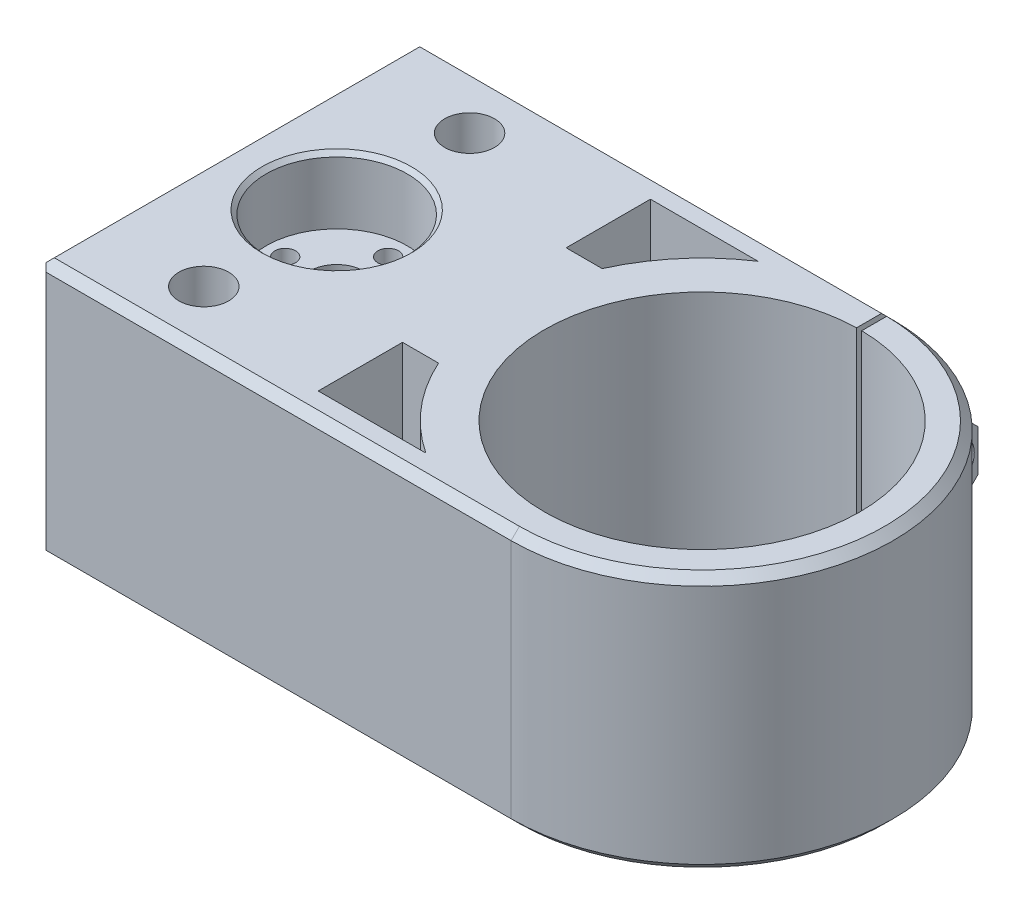
from build123d import *

# Parameters (mm, degrees)
BOSS_EXTRUDE1_DEPTH       = 31
SKETCH2_W                 = 4
SKETCH2_H                 = 6
CUT_EXTRUDE1_DEPTH        = 10
CHAMFER1_SIZE             = 3
SKETCH3_R                 = 1
CUT_EXTRUDE2_DEPTH        = 12
SKETCH4_R                 = 2.75
CUT_EXTRUDE3_DEPTH        = 3
M3X0_5_TAPPED_HOLE1_D     = 2.5
M3X0_5_TAPPED_HOLE1_DEPTH = 5.5
M3X0_5_TAPPED_HOLE1_TIP   = 0.751075774
CHAMFER2_SIZE             = 1
CHAMFER3_SIZE             = 1
CHAMFER4_SIZE             = 1
CHAMFER5_SIZE             = 1
CHAMFER6_SIZE             = 1
SKETCH6_R                 = 3
CUT_EXTRUDE4_DEPTH        = 76.325976363
SKETCH7_R                 = 8.5
CUT_EXTRUDE5_DEPTH        = 8
CHAMFER7_SIZE             = 0.5
CHAMFER8_SIZE             = 0.5
SKETCH8_R                 = 3.25
CUT_EXTRUDE6_DEPTH        = 73.401676189
SKETCH9_R                 = 1
CUT_EXTRUDE7_DEPTH        = 26
CIRPATTERN1_COUNT         = 4


with BuildPart() as part:
    # Sketch1 → Boss-Extrude1 (new body)
    with BuildSketch(Plane(origin=(0, 0, 0), x_dir=(1, 0, 0), z_dir=(0, 1, 0))):
        with BuildLine():
            Line((38.438211647, 10.935520299), (38.438211647, 20.93675572))
            Line((38.438211647, 20.93675572), (42.438211647, 20.93675572))
            Line((42.438211647, 20.93675572), (42.438211647, 14.546924278))
            ThreePointArc((42.438211647, 14.546924278), (61.123879761, -10.180568437), (38.22154498, -31.06324428))
            Line((38.22154498, -31.06324428), (-18.77845502, -31.06324428))
            Line((-18.77845502, -31.06324428), (-18.77845502, 14.93675572))
            Line((-18.77845502, 14.93675572), (33.82154498, 14.93675572))
            Line((33.82154498, 14.93675572), (33.82154498, 20.93675572))
            Line((33.82154498, 20.93675572), (37.82154498, 20.93675572))
            Line((37.82154498, 20.93675572), (37.82154498, 10.932544727))
            ThreePointArc((37.82154498, 10.932544727), (38.31322372, -27.063023095), (38.438211647, 10.935520299))
        make_face()
        with BuildLine():
            Line((12, 11.93675572), (12, 1.788697084))
            Line((12, 1.788697084), (16.336864234, 1.788697084))
            ThreePointArc((16.336864234, 1.788697084), (19.928181819, 7.472291251), (24.955045819, 11.93675572))
            Line((24.955045819, 11.93675572), (12, 11.93675572))
        make_face(mode=Mode.SUBTRACT)
        with BuildLine():
            Line((12, -17.915185645), (16.336864234, -17.915185645))
            ThreePointArc((16.336864234, -17.915185645), (19.928181819, -23.598779812), (24.955045819, -28.06324428))
            Line((24.955045819, -28.06324428), (12, -28.06324428))
            Line((12, -28.06324428), (12, -17.915185645))
        make_face(mode=Mode.SUBTRACT)
    extrude(amount=BOSS_EXTRUDE1_DEPTH)

    # Sketch2 → Cut-Extrude1 (cut)
    with BuildSketch(Plane(origin=(0, 31, 0), x_dir=(1, 0, 0), z_dir=(0, 1, 0))):
        with BuildLine():
            Line((38.438211647, 20.93675572), (38.438211647, 14.93675572))
            ThreePointArc((38.438211647, 14.93675572), (40.446719395, 14.829888823), (42.438211647, 14.547962381))
            Line((42.438211647, 14.547962381), (42.438211647, 20.93675572))
            Line((42.438211647, 20.93675572), (38.438211647, 20.93675572))
        make_face()
        with Locations((35.82154498, 17.93675572)):
            Rectangle(SKETCH2_W, SKETCH2_H)
    cut_extrude1 = extrude(amount=-CUT_EXTRUDE1_DEPTH, mode=Mode.SUBTRACT)

    # Mirror1: Cut-Extrude1 across plane
    add(cut_extrude1.mirror(Plane.ZX.offset(15.5)), mode=Mode.SUBTRACT)

    # Chamfer1
    chamfer1_edges = [part.edges().sort_by_distance(p)[0] for p in [
        (40.438211647, 10, -20.93675572),
        (35.82154498, 10, -20.93675572),
        (40.438211647, 21, -20.93675572),
        (35.82154498, 21, -20.93675572),
    ]]
    chamfer(chamfer1_edges, length=CHAMFER1_SIZE)

    # Sketch3 → Cut-Extrude2 (cut)
    with BuildSketch(Plane(origin=(42.438211647, 0, 0), x_dir=(0, 0, -1), z_dir=(1, 0, 0))):
        with Locations((17.73675572, 15.5)):
            Circle(SKETCH3_R)
    extrude(amount=-CUT_EXTRUDE2_DEPTH, mode=Mode.SUBTRACT)

    # Sketch4 → Cut-Extrude3 (cut)
    with BuildSketch(Plane(origin=(42.438211647, 0, 0), x_dir=(0, 0, -1), z_dir=(1, 0, 0))):
        with Locations((17.73675572, 15.5)):
            Circle(SKETCH4_R)
    extrude(amount=-CUT_EXTRUDE3_DEPTH, mode=Mode.SUBTRACT)

    # M3x0.5 Tapped Hole1
    with Locations(Plane(origin=(33.82154498, 15.5, -17.73675572), x_dir=(0, 0, -1), z_dir=(-1, 0, 0))):
        with Locations((0, 0)):
            Hole(M3X0_5_TAPPED_HOLE1_D / 2, depth=M3X0_5_TAPPED_HOLE1_DEPTH)
            with Locations((0, 0, -(M3X0_5_TAPPED_HOLE1_DEPTH + M3X0_5_TAPPED_HOLE1_TIP / 2))):  # 118° drill point
                Cone(0, M3X0_5_TAPPED_HOLE1_D / 2, M3X0_5_TAPPED_HOLE1_TIP, mode=Mode.SUBTRACT)

    # Chamfer2
    chamfer2_edges = [part.edges().sort_by_distance(p)[0] for p in [
        (61.123879761, 31, 10.180568437),
        (9.52154498, 31, -14.93675572),
        (-18.77845502, 31, 8.06324428),
        (9.72154498, 31, 31.06324428),
    ]]
    chamfer(chamfer2_edges, length=CHAMFER2_SIZE)

    # Chamfer3
    chamfer3_edges = [part.edges().sort_by_distance(p)[0] for p in [
        (40.446719395, 31, -14.829888823),
    ]]
    chamfer(chamfer3_edges, length=CHAMFER3_SIZE)

    # Chamfer4
    chamfer4_edges = [part.edges().sort_by_distance(p)[0] for p in [
        (9.52154498, 0, -14.93675572),
        (61.123879761, 0, 10.180568437),
        (9.72154498, 0, 31.06324428),
        (-18.77845502, 0, 8.06324428),
    ]]
    chamfer(chamfer4_edges, length=CHAMFER4_SIZE)

    # Chamfer5
    chamfer5_edges = [part.edges().sort_by_distance(p)[0] for p in [
        (40.446719395, 0, -14.829888823),
    ]]
    chamfer(chamfer5_edges, length=CHAMFER5_SIZE)

    # Chamfer6
    chamfer6_edges = [part.edges().sort_by_distance(p)[0] for p in [
        (-18.77845502, 15.5, -14.93675572),
        (-18.77845502, 15.5, 31.06324428),
    ]]
    chamfer(chamfer6_edges, length=CHAMFER6_SIZE)

    # Sketch6 → Cut-Extrude4 (cut, through all)
    with BuildSketch(Plane(origin=(0, 31, 0), x_dir=(1, 0, 0), z_dir=(0, 1, 0))):
        with Locations(Location((-5.77845502, -24.06324428, 0), (0, 0, 270))):
            Circle(SKETCH6_R)
        with Locations(Location((-5.77845502, 7.93675572, 0), (0, 0, 270))):
            Circle(SKETCH6_R)
    extrude(amount=-CUT_EXTRUDE4_DEPTH, mode=Mode.SUBTRACT)

    # Sketch7 → Cut-Extrude5 (cut)
    with BuildSketch(Plane(origin=(0, 31, 0), x_dir=(1, 0, 0), z_dir=(0, 1, 0))):
        with Locations(Location((-5.77845502, -8.06324428, 0), (0, 0, 270))):
            Circle(SKETCH7_R)
    cut_extrude5 = extrude(amount=-CUT_EXTRUDE5_DEPTH, mode=Mode.SUBTRACT)

    # Chamfer7
    chamfer7_edges = [part.edges().sort_by_distance(p)[0] for p in [
        (-5.77845502, 31, -0.43675572),
    ]]
    chamfer(chamfer7_edges, length=CHAMFER7_SIZE)

    # Mirror3: Cut-Extrude5 across plane
    add(cut_extrude5.mirror(Plane.ZX.offset(15.5)), mode=Mode.SUBTRACT)

    # Chamfer8
    chamfer8_edges = [part.edges().sort_by_distance(p)[0] for p in [
        (-5.77845502, 0, -0.43675572),
    ]]
    chamfer(chamfer8_edges, length=CHAMFER8_SIZE)

    # Sketch8 → Cut-Extrude6 (cut, through all)
    with BuildSketch(Plane(origin=(0, 23, 0), x_dir=(1, 0, 0), z_dir=(0, 1, 0))):
        with Locations(Location((-5.77845502, -8.06324428, 0), (0, 0, 270))):
            Circle(SKETCH8_R)
    extrude(amount=-CUT_EXTRUDE6_DEPTH, mode=Mode.SUBTRACT)

    # Sketch9 → Cut-Extrude7 (cut)
    with BuildSketch(Plane(origin=(0, 23, 0), x_dir=(1, 0, 0), z_dir=(0, 1, 0))):
        with Locations(Location((-5.77845502, -1.86324428, 0), (0, 0, 270))):
            Circle(SKETCH9_R)
    cut_extrude7 = extrude(amount=-CUT_EXTRUDE7_DEPTH, mode=Mode.SUBTRACT)

    # Sketch10 → M3x0.5 Tapped Hole2 (revolve, cut)
    with BuildSketch(Plane(origin=(-5.77845502, 23, 1.86324428), x_dir=(0, 0, 1), z_dir=(1, 0, 0))):
        Polygon((0, 0), (0, 27.251075774), (1.25, 26.5), (1.25, 0), align=None)
    m3x0_5_tapped_hole2 = revolve(axis=Axis((-5.77845502, 29.35, 1.86324428), (0, -1, 0)), mode=Mode.SUBTRACT)

    # CirPattern1: Cut-Extrude7, M3x0.5 Tapped Hole2 ×4 about axis
    cirpattern1_axis = Axis((-5.77845502, 0, 8.06324428), (0, 1, 0))
    add([cut_extrude7.rotate(cirpattern1_axis, i * 360 / CIRPATTERN1_COUNT) for i in range(1, CIRPATTERN1_COUNT)], mode=Mode.SUBTRACT)
    add([m3x0_5_tapped_hole2.rotate(cirpattern1_axis, i * 360 / CIRPATTERN1_COUNT) for i in range(1, CIRPATTERN1_COUNT)], mode=Mode.SUBTRACT)


solid = part.part
